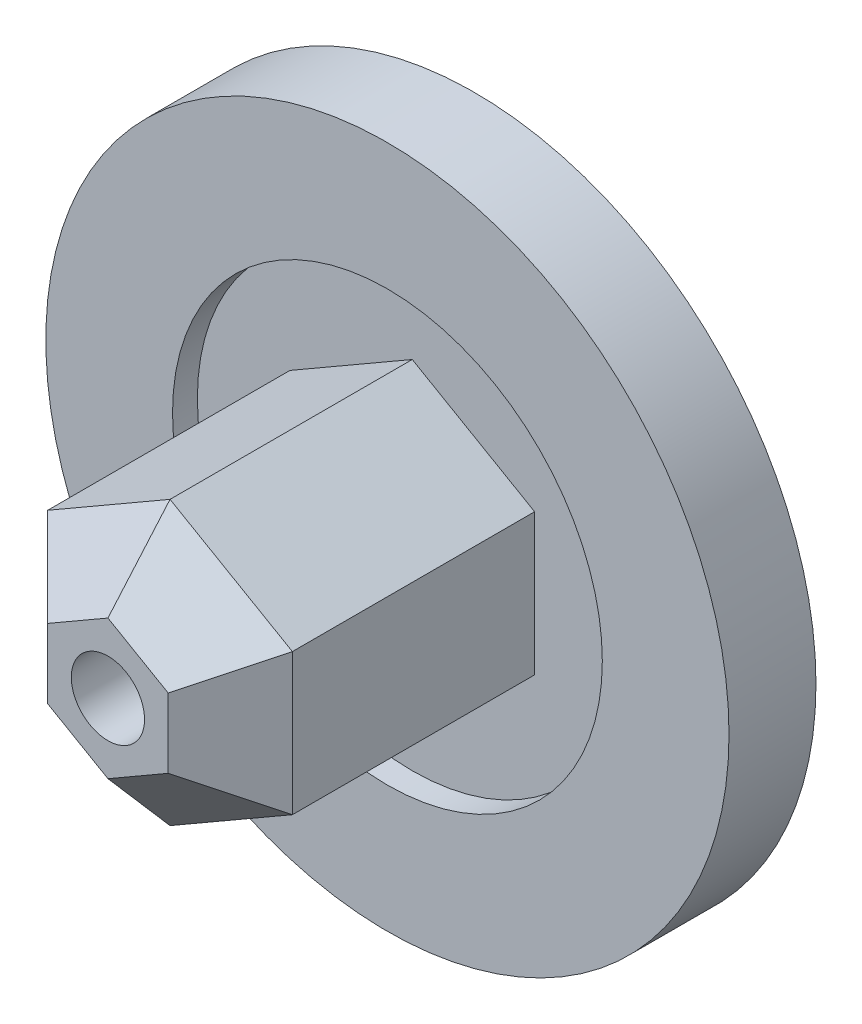
from build123d import *

# Parameters (mm, degrees)
SKETCH1_R           = 27.5
BOSS_EXTRUDE1_DEPTH = 7
SKETCH2_R           = 17.3
CUT_EXTRUDE1_DEPTH  = 2
BOSS_EXTRUDE2_DEPTH = 19.5
BOSS_EXTRUDE3_DEPTH = 5
BOSS_EXTRUDE3_TAPER = 45
SKETCH5_R           = 7.05
CUT_EXTRUDE2_DEPTH  = 16.5
SKETCH6_R           = 2.95
CUT_EXTRUDE3_DEPTH  = 43.246301613
SKETCH7_R           = 25.55
SKETCH7_R_2         = 23.75
CUT_EXTRUDE4_DEPTH  = 5
CHAMFER1_SIZE       = 0.5


with BuildPart() as part:
    # Sketch1 → Boss-Extrude1 (new body)
    with BuildSketch(Plane.XY):
        Circle(SKETCH1_R)
    extrude(amount=BOSS_EXTRUDE1_DEPTH)

    # Sketch2 → Cut-Extrude1 (cut)
    with BuildSketch(Plane.XY.offset(7)):
        Circle(SKETCH2_R)
    extrude(amount=-CUT_EXTRUDE1_DEPTH, mode=Mode.SUBTRACT)

    # Sketch3 → Boss-Extrude2 (add)
    with BuildSketch(Plane.XY.offset(5)):
        Polygon((0, 11.373800303), (-9.85, 5.686900152), (-9.85, -5.686900152), (0, -11.373800303), (9.85, -5.686900152), (9.85, 5.686900152), align=None)
    extrude(amount=BOSS_EXTRUDE2_DEPTH)

    # Sketch4 → Boss-Extrude3 (add)
    with BuildSketch(Plane.XY.offset(24.5)):
        Polygon((9.85, 5.686900152), (0, 11.373800303), (-9.85, 5.686900152), (-9.85, -5.686900152), (0, -11.373800303), (9.85, -5.686900152), align=None)
    extrude(amount=BOSS_EXTRUDE3_DEPTH, taper=BOSS_EXTRUDE3_TAPER)

    # Sketch5 → Cut-Extrude2 (cut)
    with BuildSketch(Plane(origin=(0, 0, 0), x_dir=(-1, 0, 0), z_dir=(0, 0, -1))):
        Circle(SKETCH5_R)
    extrude(amount=-CUT_EXTRUDE2_DEPTH, mode=Mode.SUBTRACT)

    # Sketch6 → Cut-Extrude3 (cut, through all)
    with BuildSketch(Plane(origin=(0, 0, 16.5), x_dir=(-1, 0, 0), z_dir=(0, 0, -1))):
        Circle(SKETCH6_R)
    extrude(amount=-CUT_EXTRUDE3_DEPTH, mode=Mode.SUBTRACT)

    # Sketch7 → Cut-Extrude4 (cut)
    with BuildSketch(Plane(origin=(0, 0, 0), x_dir=(-1, 0, 0), z_dir=(0, 0, -1))):
        Circle(SKETCH7_R)
        Circle(SKETCH7_R_2, mode=Mode.SUBTRACT)
    extrude(amount=-CUT_EXTRUDE4_DEPTH, mode=Mode.SUBTRACT)

    # Chamfer1
    chamfer1_edges = [part.edges().sort_by_distance(p)[0] for p in [
        (25.55, 0, 0),
        (23.75, 0, 0),
    ]]
    chamfer(chamfer1_edges, length=CHAMFER1_SIZE)


solid = part.part
